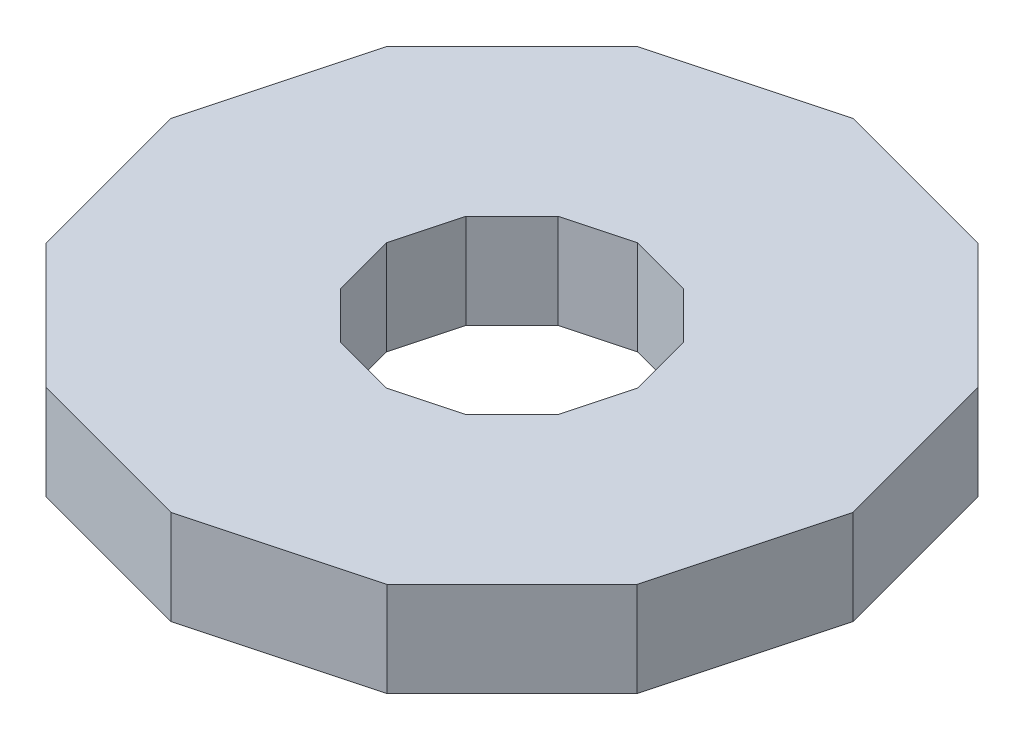
from build123d import *

# Parameters (mm, degrees)
BOSS_EXTRUDE1_DEPTH = 19.05


with BuildPart() as part:
    # Sketch1 → Boss-Extrude1 (new body)
    with BuildSketch(Plane(origin=(0, 0, 0), x_dir=(1, 0, 0), z_dir=(0, 1, 0))):
        Polygon((68.696644766, 0), (59.493039522, 34.348322383), (34.348322383, 59.493039522), (0, 68.696644766), (-34.348322383, 59.493039522), (-59.493039522, 34.348322383), (-68.696644766, 0), (-59.493039522, -34.348322383), (-34.348322383, -59.493039522), (0, -68.696644766), (34.348322383, -59.493039522), (59.493039522, -34.348322383), align=None)
        Polygon((25.308220045, 0), (21.917561483, 12.654110022), (12.654110022, 21.917561483), (0, 25.308220045), (-12.654110022, 21.917561483), (-21.917561483, 12.654110022), (-25.308220045, 0), (-21.917561483, -12.654110022), (-12.654110022, -21.917561483), (0, -25.308220045), (12.654110022, -21.917561483), (21.917561483, -12.654110022), align=None, mode=Mode.SUBTRACT)
    extrude(amount=BOSS_EXTRUDE1_DEPTH)


solid = part.part
